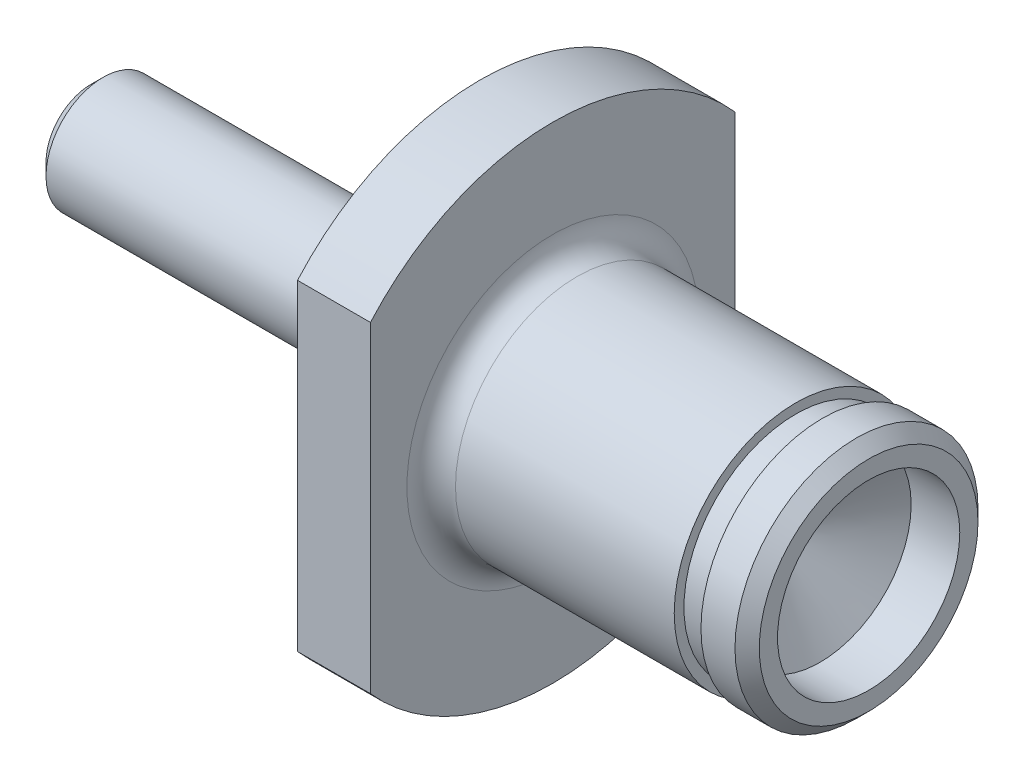
from build123d import *

# Parameters (mm, degrees)
SFAZOWANIE1_SIZE               = 0.5
ZAOKR_GLENIE1_R                = 0.5
OTWORY_USTALAJ_CE_8_0MM1_D     = 7.5
OTWORY_USTALAJ_CE_8_0MM1_DEPTH = 2
OTWORY_USTALAJ_CE_8_0MM1_TIP   = 2.253227321
ZAOKR_GLENIE2_R                = 1
SFAZOWANIE2_SIZE               = 0.5
WYTNIJ_WYCI_GNI_CIE1_DEPTH     = 3


with BuildPart() as part:
    # Szkic1 → Obrót1 (revolve)
    with BuildSketch(Plane.XY, mode=Mode.PRIVATE) as obr_t1_sk:
        Polygon((0, 0), (0, 2.35), (16, 2.35), (16, 10), (19, 10), (19, 5), (29, 5), (29, 4.6), (30.1, 4.6), (30.1, 5), (32, 5), (32, 0), align=None)
    revolve(obr_t1_sk.sketch.rotate(Axis((0, 0, 0), (-1, 0, 0)), 90), axis=Axis((0, 0, 0), (-1, 0, 0)))

    # Sfazowanie1
    sfazowanie1_edges = [part.edges().sort_by_distance(p)[0] for p in [
        (0, 0, 2.35),
    ]]
    chamfer(sfazowanie1_edges, length=SFAZOWANIE1_SIZE)

    # Zaokrąglenie1
    zaokr_glenie1_edges = [part.edges().sort_by_distance(p)[0] for p in [
        (16, 0, 2.35),
    ]]
    fillet(zaokr_glenie1_edges, radius=ZAOKR_GLENIE1_R)

    # Otwory ustalające Ø8.0mm1
    with Locations(Plane(origin=(32, 0, 0), x_dir=(0, 0, -1), z_dir=(1, 0, 0))):
        with Locations((0, 0)):
            Hole(OTWORY_USTALAJ_CE_8_0MM1_D / 2, depth=OTWORY_USTALAJ_CE_8_0MM1_DEPTH)
            with Locations((0, 0, -(OTWORY_USTALAJ_CE_8_0MM1_DEPTH + OTWORY_USTALAJ_CE_8_0MM1_TIP / 2))):  # 118° drill point
                Cone(0, OTWORY_USTALAJ_CE_8_0MM1_D / 2, OTWORY_USTALAJ_CE_8_0MM1_TIP, mode=Mode.SUBTRACT)

    # Zaokrąglenie2
    zaokr_glenie2_edges = [part.edges().sort_by_distance(p)[0] for p in [
        (19, 0, 5),
    ]]
    fillet(zaokr_glenie2_edges, radius=ZAOKR_GLENIE2_R)

    # Sfazowanie2
    sfazowanie2_edges = [part.edges().sort_by_distance(p)[0] for p in [
        (32, 0, 5),
    ]]
    chamfer(sfazowanie2_edges, length=SFAZOWANIE2_SIZE)

    # Szkic5 → Wytnij-wyciągnięcie1 (cut)
    with BuildSketch(Plane(origin=(19, 0, 0), x_dir=(0, 0, -1), z_dir=(1, 0, 0))):
        with BuildLine():
            Line((7.5, 6.614378278), (7.5, -6.614378278))
            ThreePointArc((7.5, -6.614378278), (9.354143467, -3.535533906), (10, 0))
            ThreePointArc((10, 0), (9.354143467, 3.535533906), (7.5, 6.614378278))
        make_face()
        with BuildLine():
            ThreePointArc((-7.5, 6.614378278), (-10, 0), (-7.5, -6.614378278))
            Line((-7.5, -6.614378278), (-7.5, 6.614378278))
        make_face()
    extrude(amount=-WYTNIJ_WYCI_GNI_CIE1_DEPTH, mode=Mode.SUBTRACT)


solid = part.part
